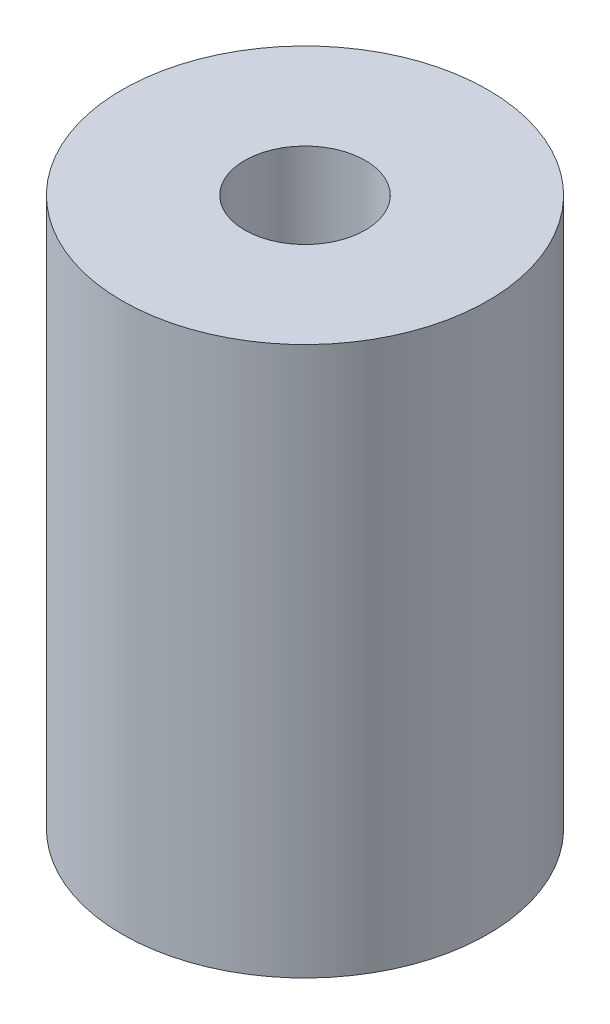
from build123d import *

# Parameters (mm, degrees)
SKETCH_1_R      = 5
SKETCH_1_R_2    = 1.65
EXTRUDE_1_DEPTH = 15


with BuildPart() as part:
    # Эскиз1 → Бобышка-Вытянуть1 (new body)
    with BuildSketch(Plane(origin=(0, 0, 0), x_dir=(1, 0, 0), z_dir=(0, 1, 0))):
        with Locations(Location((0, 0, 0), (0, 0, 270))):
            Circle(SKETCH_1_R)
        with Locations(Location((0, 0, 0), (0, 0, 270))):
            Circle(SKETCH_1_R_2, mode=Mode.SUBTRACT)
    extrude(amount=EXTRUDE_1_DEPTH)


solid = part.part
